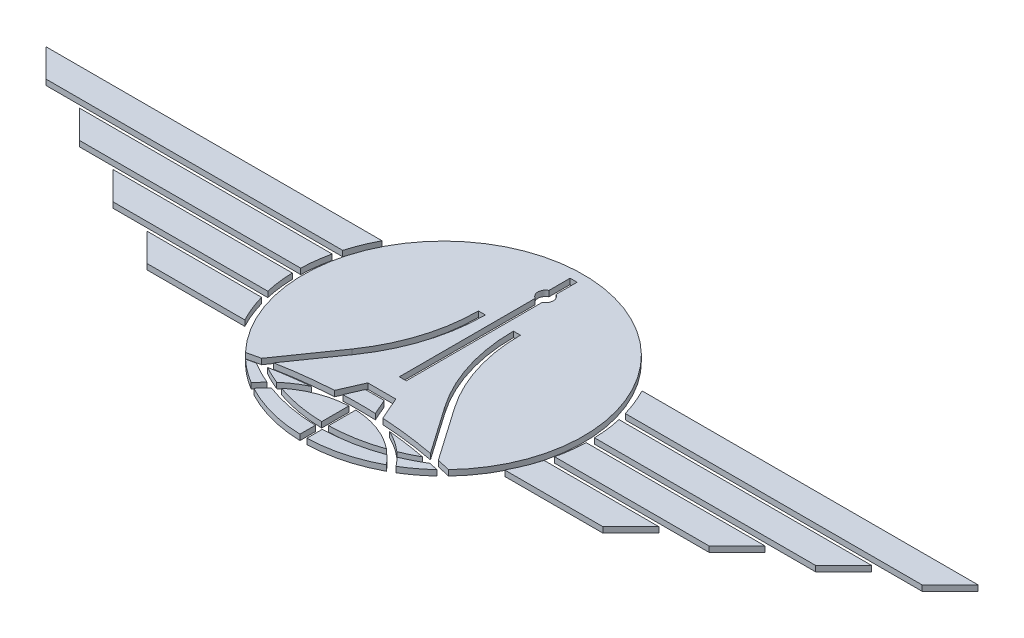
from build123d import *

# Parameters (mm, degrees)
EXTRUDE_2_DEPTH    = 2
EXTRUDE_2_2_DEPTH  = 2
EXTRUDE_2_3_DEPTH  = 2
EXTRUDE_2_4_DEPTH  = 2
EXTRUDE_2_5_DEPTH  = 2
EXTRUDE_2_6_DEPTH  = 2
EXTRUDE_2_7_DEPTH  = 2
EXTRUDE_2_8_DEPTH  = 2
EXTRUDE_2_9_DEPTH  = 2
EXTRUDE_2_10_DEPTH = 2
EXTRUDE_3_DEPTH    = 2
EXTRUDE_3_2_DEPTH  = 2
EXTRUDE_3_3_DEPTH  = 2
EXTRUDE_3_4_DEPTH  = 2
EXTRUDE_3_5_DEPTH  = 2
EXTRUDE_3_6_DEPTH  = 2
EXTRUDE_3_7_DEPTH  = 2
EXTRUDE_3_8_DEPTH  = 2


with BuildPart() as part:
    # 草图1 → 凸台-拉伸2 (new body)
    with BuildSketch(Plane(origin=(0, 0, 0), x_dir=(1, 0, 0), z_dir=(0, 1, 0))):
        with BuildLine():
            Line((5, -22), (-5, -22))
            Line((-5, -22), (-8.603844932, -30.246957118))
            ThreePointArc((-8.603844932, -30.246957118), (-18.340879186, -31.125515448), (-28, -32.636503842))
            Line((-28, -32.636503842), (-16.220094524, -15.729837593))
            ThreePointArc((-16.220094524, -15.729837593), (-7.870963062, 1.274937814), (-5, 20))
            Line((-5, 20), (-7.5, 20))
            ThreePointArc((-7.5, 20), (-10.25612454, 2.023940301), (-18.271290743, -14.300644089))
            Line((-18.271290743, -14.300644089), (-31.547646388, -33.355034156))
            ThreePointArc((-31.547646388, -33.355034156), (-33.899873465, -33.880875382), (-36.243347623, -34.444444444))
            ThreePointArc((-36.243347623, -34.444444444), (0, 50), (36.243347623, -34.444444444))
            ThreePointArc((36.243347623, -34.444444444), (33.899873465, -33.880875382), (31.547646388, -33.355034156))
            Line((31.547646388, -33.355034156), (18.271290743, -14.300644089))
            ThreePointArc((18.271290743, -14.300644089), (10.25612454, 2.023940301), (7.5, 20))
            Line((7.5, 20), (5, 20))
            ThreePointArc((5, 20), (7.870963062, 1.274937814), (16.220094524, -15.729837593))
            Line((16.220094524, -15.729837593), (28, -32.636503842))
            ThreePointArc((28, -32.636503842), (18.340879186, -31.125515448), (8.603844932, -30.246957118))
            Line((8.603844932, -30.246957118), (5, -22))
        make_face()
        with BuildLine():
            Line((-1.25, 46.483195888), (-1.25, 38.949489743))
            ThreePointArc((-1.25, 38.949489743), (-2.75, 36.5), (-1.25, 34.050510257))
            Line((-1.25, 34.050510257), (-1.25, -14.5))
            Line((-1.25, -14.5), (1.25, -14.5))
            Line((1.25, -14.5), (1.25, 34.050510257))
            ThreePointArc((1.25, 34.050510257), (2.75, 36.5), (1.25, 38.949489743))
            Line((1.25, 38.949489743), (1.25, 46.483195888))
            ThreePointArc((1.25, 46.483195888), (0, 46.5), (-1.25, 46.483195888))
        make_face(mode=Mode.SUBTRACT)
    extrude(amount=EXTRUDE_2_DEPTH)


with BuildPart() as body_2:
    # 草图1 → Extrude 2 2 (new body)
    with BuildSketch(Plane(origin=(0, 0, 0), x_dir=(1, 0, 0), z_dir=(0, 1, 0))):
        with BuildLine():
            Line((3.364198155, -24.5), (5.816954605, -30.112832307))
            ThreePointArc((5.816954605, -30.112832307), (0, -30), (-5.816954605, -30.112832307))
            Line((-5.816954605, -30.112832307), (-3.364198155, -24.5))
            Line((-3.364198155, -24.5), (3.364198155, -24.5))
        make_face()
    extrude(amount=EXTRUDE_2_2_DEPTH)


with BuildPart() as body_3:
    # 草图1 → Extrude 2 3 (new body)
    with BuildSketch(Plane(origin=(0, 0, 0), x_dir=(1, 0, 0), z_dir=(0, 1, 0))):
        with BuildLine():
            Line((-1.25, -32.526052979), (-1.25, -42.236352085))
            ThreePointArc((-1.25, -42.236352085), (-10.127900791, -41.347032979), (-18.759807178, -39.089112903))
            ThreePointArc((-18.759807178, -39.089112903), (-10.529317866, -34.408480545), (-1.25, -32.526052979))
        make_face()
    extrude(amount=EXTRUDE_2_3_DEPTH)


with BuildPart() as body_4:
    # 草图1 → Extrude 2 4 (new body)
    with BuildSketch(Plane(origin=(0, 0, 0), x_dir=(1, 0, 0), z_dir=(0, 1, 0))):
        with BuildLine():
            Line((1.25, -32.526052979), (1.25, -42.236352085))
            ThreePointArc((1.25, -42.236352085), (10.127900791, -41.347032979), (18.759807178, -39.089112903))
            ThreePointArc((18.759807178, -39.089112903), (10.529317866, -34.408480545), (1.25, -32.526052979))
        make_face()
    extrude(amount=EXTRUDE_2_4_DEPTH)


with BuildPart() as body_5:
    # 草图1 → Extrude 2 5 (new body)
    with BuildSketch(Plane(origin=(0, 0, 0), x_dir=(1, 0, 0), z_dir=(0, 1, 0))):
        with BuildLine():
            Line((1.25, -44.486868299), (1.25, -49.984372558))
            ThreePointArc((1.25, -49.984372558), (12.801526381, -48.333434828), (23.655813239, -44.05))
            ThreePointArc((23.655813239, -44.05), (22.236983731, -42.362558391), (20.698061258, -40.783870968))
            ThreePointArc((20.698061258, -40.783870968), (11.129123755, -43.44991535), (1.25, -44.486868299))
        make_face()
    extrude(amount=EXTRUDE_2_5_DEPTH)


with BuildPart() as body_6:
    # 草图1 → Extrude 2 6 (new body)
    with BuildSketch(Plane(origin=(0, 0, 0), x_dir=(1, 0, 0), z_dir=(0, 1, 0))):
        with BuildLine():
            Line((-1.25, -44.486868299), (-1.25, -49.984372558))
            ThreePointArc((-1.25, -49.984372558), (-12.801526381, -48.333434828), (-23.655813239, -44.05))
            ThreePointArc((-23.655813239, -44.05), (-22.236983731, -42.362558391), (-20.698061258, -40.783870968))
            ThreePointArc((-20.698061258, -40.783870968), (-11.129123755, -43.44991535), (-1.25, -44.486868299))
        make_face()
    extrude(amount=EXTRUDE_2_6_DEPTH)


with BuildPart() as body_7:
    # 草图1 → Extrude 2 7 (new body)
    with BuildSketch(Plane(origin=(0, 0, 0), x_dir=(1, 0, 0), z_dir=(0, 1, 0))):
        with BuildLine():
            ThreePointArc((-34.161227654, -36.510416667), (-30.169360311, -39.872417765), (-25.848791074, -42.8))
            ThreePointArc((-25.848791074, -42.8), (-24.588388651, -41.247679102), (-23.234909674, -39.775806452))
            ThreePointArc((-23.234909674, -39.775806452), (-27.185607417, -37.926295444), (-30.990183596, -35.792307692))
            ThreePointArc((-30.990183596, -35.792307692), (-32.577684342, -36.14262451), (-34.161227654, -36.510416667))
        make_face()
    extrude(amount=EXTRUDE_2_7_DEPTH)


with BuildPart() as body_8:
    # 草图1 → Extrude 2 8 (new body)
    with BuildSketch(Plane(origin=(0, 0, 0), x_dir=(1, 0, 0), z_dir=(0, 1, 0))):
        with BuildLine():
            ThreePointArc((34.161227654, -36.510416667), (32.577684342, -36.14262451), (30.990183596, -35.792307692))
            ThreePointArc((30.990183596, -35.792307692), (27.185607417, -37.926295444), (23.234909674, -39.775806452))
            ThreePointArc((23.234909674, -39.775806452), (24.588388651, -41.247679102), (25.848791074, -42.8))
            ThreePointArc((25.848791074, -42.8), (30.169360311, -39.872417765), (34.161227654, -36.510416667))
        make_face()
    extrude(amount=EXTRUDE_2_8_DEPTH)


with BuildPart() as body_9:
    # 草图1 → Extrude 2 9 (new body)
    with BuildSketch(Plane(origin=(0, 0, 0), x_dir=(1, 0, 0), z_dir=(0, 1, 0))):
        with BuildLine():
            ThreePointArc((-13.989336421, -33.164893617), (-20.852966584, -33.981495061), (-27.67080408, -35.11875))
            ThreePointArc((-27.67080408, -35.11875), (-24.603420808, -36.693657102), (-21.446790019, -38.081048387))
            ThreePointArc((-21.446790019, -38.081048387), (-17.887758627, -35.365555261), (-13.989336421, -33.164893617))
        make_face()
    extrude(amount=EXTRUDE_2_9_DEPTH)


with BuildPart() as body_10:
    # 草图1 → Extrude 2 10 (new body)
    with BuildSketch(Plane(origin=(0, 0, 0), x_dir=(1, 0, 0), z_dir=(0, 1, 0))):
        with BuildLine():
            ThreePointArc((27.67080408, -35.11875), (20.852966584, -33.981495061), (13.989336421, -33.164893617))
            ThreePointArc((13.989336421, -33.164893617), (17.887758627, -35.365555261), (21.446790019, -38.081048387))
            ThreePointArc((21.446790019, -38.081048387), (24.603420808, -36.693657102), (27.67080408, -35.11875))
        make_face()
    extrude(amount=EXTRUDE_2_10_DEPTH)


with BuildPart() as body_11:
    # 草图2 → 凸台-拉伸3 (new body)
    with BuildSketch(Plane(origin=(0, 2, 0), x_dir=(1, 0, 0), z_dir=(0, 1, 0))):
        with BuildLine():
            Line((141.432747065, 11.5), (131.432747065, 1.5))
            Line((131.432747065, 1.5), (52.478567054, 1.5))
            ThreePointArc((52.478567054, 1.5), (52.092294426, 6.530150183), (51.224993899, 11.5))
            Line((51.224993899, 11.5), (141.432747065, 11.5))
        make_face()
    extrude(amount=-EXTRUDE_3_DEPTH)


with BuildPart() as body_12:
    # 草图2 → Extrude 3 2 (new body)
    with BuildSketch(Plane(origin=(0, 2, 0), x_dir=(1, 0, 0), z_dir=(0, 1, 0))):
        with BuildLine():
            Line((-156.432747065, 14.5), (-50.457903246, 14.5))
            ThreePointArc((-50.457903246, 14.5), (-48.7026645, 19.603583105), (-46.432747065, 24.5))
            Line((-46.432747065, 24.5), (-166.432747065, 24.5))
            Line((-166.432747065, 24.5), (-156.432747065, 14.5))
        make_face()
    extrude(amount=-EXTRUDE_3_2_DEPTH)


with BuildPart() as body_13:
    # 草图2 → Extrude 3 3 (new body)
    with BuildSketch(Plane(origin=(0, 2, 0), x_dir=(1, 0, 0), z_dir=(0, 1, 0))):
        with BuildLine():
            Line((116.432747065, -1.5), (106.432747065, -11.5))
            Line((106.432747065, -11.5), (51.224993899, -11.5))
            ThreePointArc((51.224993899, -11.5), (52.092294426, -6.530150183), (52.478567054, -1.5))
            Line((52.478567054, -1.5), (116.432747065, -1.5))
        make_face()
    extrude(amount=-EXTRUDE_3_3_DEPTH)


with BuildPart() as body_14:
    # 草图2 → Extrude 3 4 (new body)
    with BuildSketch(Plane(origin=(0, 2, 0), x_dir=(1, 0, 0), z_dir=(0, 1, 0))):
        with BuildLine():
            Line((91.432747065, -14.5), (81.432747065, -24.5))
            Line((81.432747065, -24.5), (46.432747065, -24.5))
            ThreePointArc((46.432747065, -24.5), (48.7026645, -19.603583105), (50.457903246, -14.5))
            Line((50.457903246, -14.5), (91.432747065, -14.5))
        make_face()
    extrude(amount=-EXTRUDE_3_4_DEPTH)


with BuildPart() as body_15:
    # 草图2 → Extrude 3 5 (new body)
    with BuildSketch(Plane(origin=(0, 2, 0), x_dir=(1, 0, 0), z_dir=(0, 1, 0))):
        with BuildLine():
            Line((166.432747065, 24.5), (156.432747065, 14.5))
            Line((156.432747065, 14.5), (50.457903246, 14.5))
            ThreePointArc((50.457903246, 14.5), (48.7026645, 19.603583105), (46.432747065, 24.5))
            Line((46.432747065, 24.5), (166.432747065, 24.5))
        make_face()
    extrude(amount=-EXTRUDE_3_5_DEPTH)


with BuildPart() as body_16:
    # 草图2 → Extrude 3 6 (new body)
    with BuildSketch(Plane(origin=(0, 2, 0), x_dir=(1, 0, 0), z_dir=(0, 1, 0))):
        with BuildLine():
            Line((-81.432747065, -24.5), (-46.432747065, -24.5))
            ThreePointArc((-46.432747065, -24.5), (-48.7026645, -19.603583105), (-50.457903246, -14.5))
            Line((-50.457903246, -14.5), (-91.432747065, -14.5))
            Line((-91.432747065, -14.5), (-81.432747065, -24.5))
        make_face()
    extrude(amount=-EXTRUDE_3_6_DEPTH)


with BuildPart() as body_17:
    # 草图2 → Extrude 3 7 (new body)
    with BuildSketch(Plane(origin=(0, 2, 0), x_dir=(1, 0, 0), z_dir=(0, 1, 0))):
        with BuildLine():
            Line((-116.432747065, -1.5), (-52.478567054, -1.5))
            ThreePointArc((-52.478567054, -1.5), (-52.092294426, -6.530150183), (-51.224993899, -11.5))
            Line((-51.224993899, -11.5), (-106.432747065, -11.5))
            Line((-106.432747065, -11.5), (-116.432747065, -1.5))
        make_face()
    extrude(amount=-EXTRUDE_3_7_DEPTH)


with BuildPart() as body_18:
    # 草图2 → Extrude 3 8 (new body)
    with BuildSketch(Plane(origin=(0, 2, 0), x_dir=(1, 0, 0), z_dir=(0, 1, 0))):
        with BuildLine():
            Line((-141.432747065, 11.5), (-51.224993899, 11.5))
            ThreePointArc((-51.224993899, 11.5), (-52.092294426, 6.530150183), (-52.478567054, 1.5))
            Line((-52.478567054, 1.5), (-131.432747065, 1.5))
            Line((-131.432747065, 1.5), (-141.432747065, 11.5))
        make_face()
    extrude(amount=-EXTRUDE_3_8_DEPTH)


solid = Compound([part.part, body_2.part, body_3.part, body_4.part, body_5.part, body_6.part, body_7.part, body_8.part, body_9.part, body_10.part, body_11.part, body_12.part, body_13.part, body_14.part, body_15.part, body_16.part, body_17.part, body_18.part])
